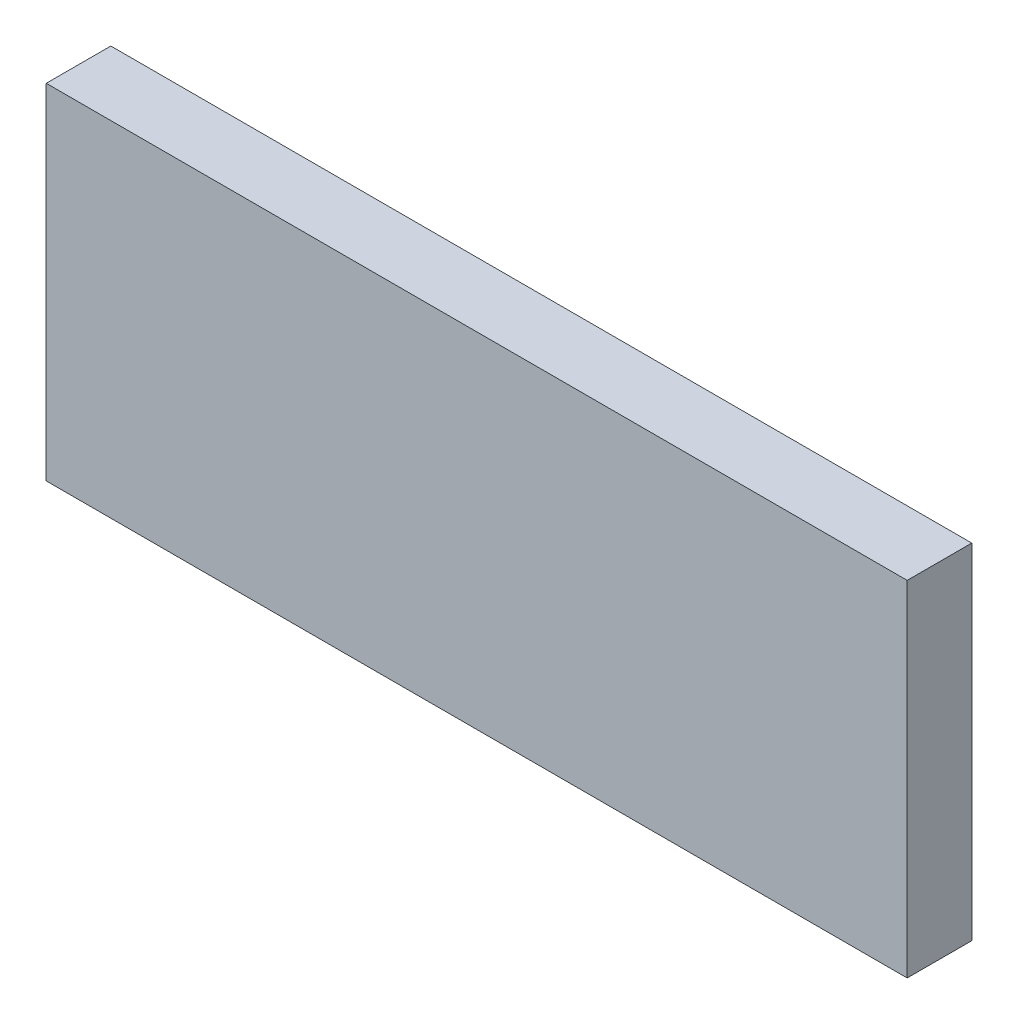
from build123d import *

# Parameters (mm, degrees)
SKIZZE1_W                       = 200
SKIZZE1_H                       = 80
AUFSATZ_LINEAR_AUSTRAGEN1_DEPTH = 15


with BuildPart() as part:
    # Skizze1 → Aufsatz-Linear austragen1 (new body)
    with BuildSketch(Plane.XY):
        Rectangle(SKIZZE1_W, SKIZZE1_H)
    extrude(amount=AUFSATZ_LINEAR_AUSTRAGEN1_DEPTH)


solid = part.part
